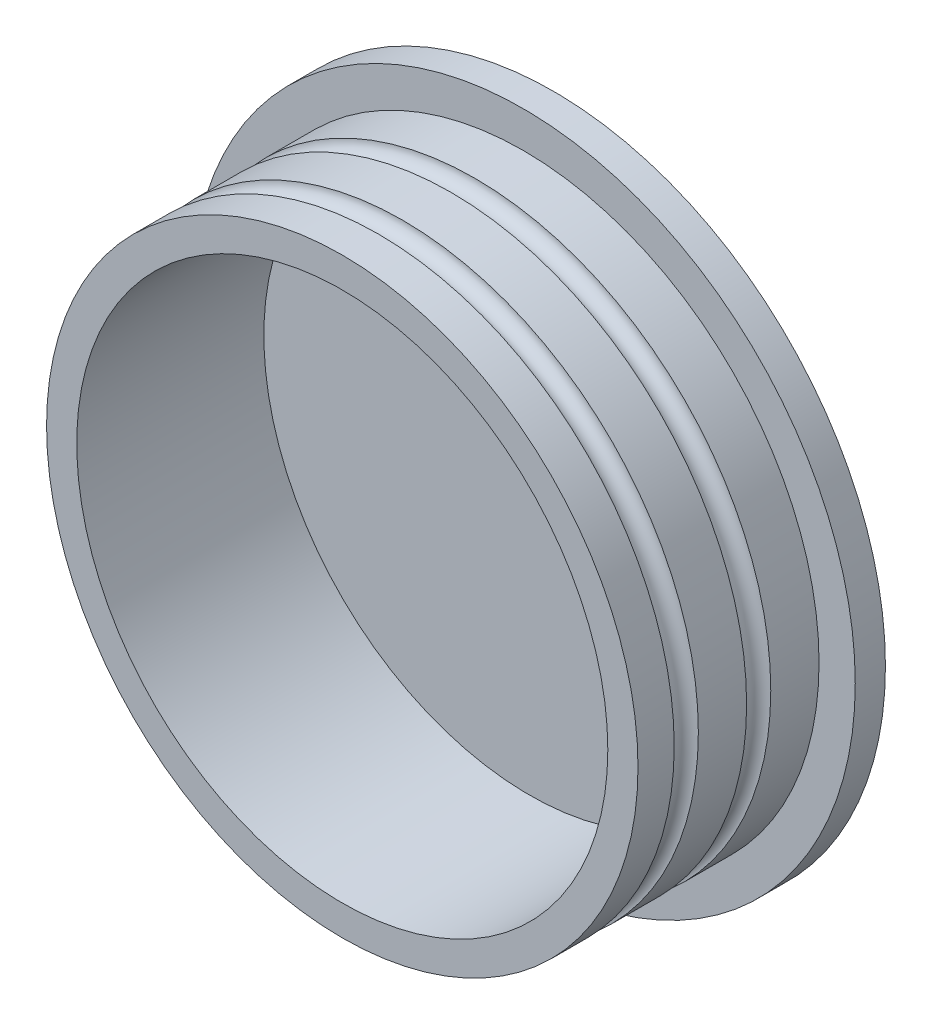
from build123d import *

# Parameters (mm, degrees)
CROQUIS1_R              = 55
SALIENTE_EXTRUIR1_DEPTH = 5
CROQUIS2_R              = 49
SALIENTE_EXTRUIR2_DEPTH = 30
CROQUIS3_R              = 2
CROQUIS4_R              = 44
CORTAR_EXTRUIR1_DEPTH   = 31


with BuildPart() as part:
    # Croquis1 → Saliente-Extruir1 (new body)
    with BuildSketch(Plane.XY):
        Circle(CROQUIS1_R)
    extrude(amount=SALIENTE_EXTRUIR1_DEPTH)

    # Croquis2 → Saliente-Extruir2 (add)
    with BuildSketch(Plane.XY.offset(5)):
        Circle(CROQUIS2_R)
    extrude(amount=SALIENTE_EXTRUIR2_DEPTH)

    # Croquis3 → Cortar-Revolución1 (revolve, cut)
    with BuildSketch(Plane(origin=(0, 0, 0), x_dir=(1, 0, 0), z_dir=(0, 1, 0)), mode=Mode.PRIVATE) as cortar_revoluci_n1_sk:
        with Locations((-49, -15)):
            Circle(CROQUIS3_R)
        with Locations((-49, -27)):
            Circle(CROQUIS3_R)
    revolve(cortar_revoluci_n1_sk.sketch.rotate(Axis((0, 0, 36.878025431), (0, 0, -1)), 180), axis=Axis((0, 0, 36.878025431), (0, 0, -1)), mode=Mode.SUBTRACT)

    # Croquis4 → Cortar-Extruir1 (cut)
    with BuildSketch(Plane.XY.offset(35)):
        Circle(CROQUIS4_R)
    extrude(amount=-CORTAR_EXTRUIR1_DEPTH, mode=Mode.SUBTRACT)


solid = part.part
